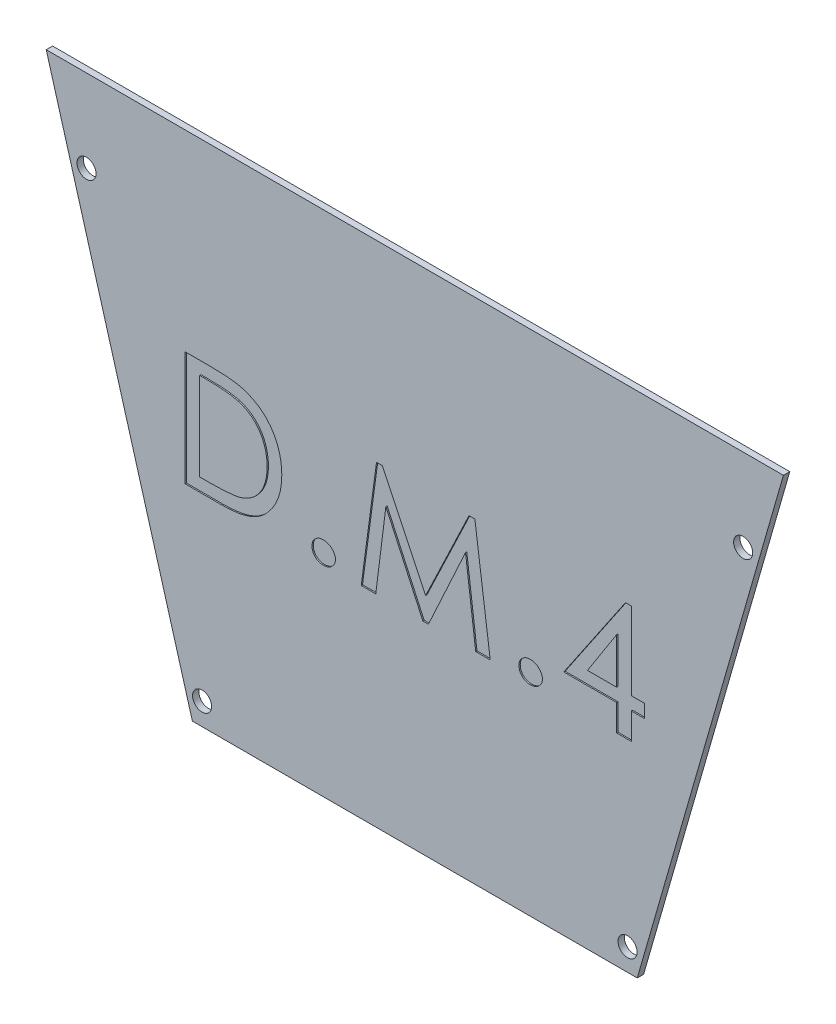
from build123d import *

# Parameters (mm, degrees)
SKETCH4_R           = 1.5
BOSS_EXTRUDE2_DEPTH = 2
CUT_EXTRUDE3_DEPTH  = 1.2
SKETCH5_W           = 128.44998767
SKETCH5_H           = 88.567800429
CUT_EXTRUDE4_DEPTH  = 1


with BuildPart() as part:
    # Sketch4 → Boss-Extrude2 (new body)
    with BuildSketch(Plane.XY):
        Polygon((-47.494923858, -80), (22.505076142, -80), (45.505076142, 0), (-70.494923858, 0), align=None)
        with Locations((-64.156154636, -13)):
            Circle(SKETCH4_R, mode=Mode.SUBTRACT)
        with Locations((39.166306921, -13)):
            Circle(SKETCH4_R, mode=Mode.SUBTRACT)
        with Locations((20.975017364, -76.5)):
            Circle(SKETCH4_R, mode=Mode.SUBTRACT)
        with Locations((-45.96486508, -76.5)):
            Circle(SKETCH4_R, mode=Mode.SUBTRACT)
    extrude(amount=BOSS_EXTRUDE2_DEPTH)

    # Sketch3 → Cut-Extrude3 (cut)
    # profile 1 of 5: a face of its own
    with BuildSketch(Plane.XY.offset(2)):
        with BuildLine():
            Line((-48.652053032, -48.226415595), (-48.652053032, -30.234748929))
            Line((-48.652053032, -30.234748929), (-44.842519445, -30.234748929))
            add(Edge.make_bspline(
                [(-44.842519445, -30.234748929), (-44.521732269, -30.236984898), (-43.904050046, -30.241290301), (-43.011097962, -30.269525004), (-42.187594278, -30.318075085), (-41.431774393, -30.391255361), (-40.744397653, -30.4773218), (-40.125682471, -30.591186172), (-39.573264137, -30.713931405), (-39.23499855, -30.826811234), (-39.075959616, -30.87988281)],
                knots=[0, 0, 0, 0, 1.321377177, 2.544338591, 3.679698859, 4.71869479, 5.671952218, 6.531967125, 7.309789724, 8, 8, 8, 8], degree=3))
            add(Edge.make_bspline(
                [(-39.075959616, -30.87988281), (-38.85328765, -30.963788376), (-38.413791158, -31.129396122), (-37.791084053, -31.440263208), (-37.202775864, -31.781317579), (-36.656196712, -32.168455074), (-36.152390349, -32.599236902), (-35.682710646, -33.064254187), (-35.26164963, -33.577064823), (-34.875955514, -34.123196107), (-34.53421448, -34.703279623), (-34.238407999, -35.309695911), (-33.988574294, -35.941280549), (-33.783106651, -36.596425788), (-33.625638845, -37.276310988), (-33.509278481, -37.979086465), (-33.439750425, -38.706570709), (-33.432172128, -39.200397751), (-33.428335083, -39.450432356)],
                knots=[0, 0, 0, 0, 1.037989101, 2.048720264, 3.03347809, 4.003905725, 4.967380877, 5.923996735, 6.884742632, 7.859453364, 8.839691521, 9.819957728, 10.801471334, 11.80152298, 12.813966534, 13.844978706, 14.908869198, 16, 16, 16, 16], degree=3))
            add(Edge.make_bspline(
                [(-33.428335083, -39.450432356), (-33.431687273, -39.666796352), (-33.438309227, -40.094204144), (-33.494324081, -40.727210114), (-33.582972853, -41.342450534), (-33.709687032, -41.939530979), (-33.871706572, -42.517606235), (-34.071313773, -43.078299747), (-34.304009234, -43.622326227), (-34.575295239, -44.143488737), (-34.872666915, -44.640220911), (-35.197779254, -45.105368313), (-35.544154758, -45.539087338), (-35.912590068, -45.941421262), (-36.306511511, -46.310238673), (-36.725402521, -46.645257464), (-37.166786838, -46.94990625), (-37.634932409, -47.222083119), (-38.138587554, -47.464070392), (-38.687036048, -47.667176718), (-39.281362533, -47.838976891), (-39.920972409, -47.985046491), (-40.609225659, -48.089034767), (-41.342714631, -48.167737193), (-42.121853938, -48.22071111), (-42.657143011, -48.224478632), (-42.932346501, -48.226415595)],
                knots=[0, 0, 0, 0, 1.058131973, 2.090245403, 3.105765157, 4.096918797, 5.07359586, 6.040054961, 7.006085223, 7.965371986, 8.911666288, 9.835956746, 10.738988486, 11.624821356, 12.502036588, 13.375701924, 14.24610047, 15.122941669, 16.021834204, 16.975760622, 17.979893693, 19.046217526, 20.182340398, 21.382202726, 22.654134781, 24, 24, 24, 24], degree=3))
            Line((-42.932346501, -48.226415595), (-48.652053032, -48.226415595))
        make_face()
        with BuildLine():
            Line((-46.3454291, -46.150454057), (-44.781249747, -46.150454057))
            add(Edge.make_bspline(
                [(-44.781249747, -46.150454057), (-44.492899092, -46.149343471), (-43.938936926, -46.147209879), (-43.142408274, -46.1235595), (-42.415026871, -46.095321415), (-41.759126132, -46.042892613), (-41.17326892, -45.984380401), (-40.657443035, -45.908775227), (-40.209539607, -45.823754328), (-39.939260695, -45.743914961), (-39.814800094, -45.70714977)],
                knots=[0, 0, 0, 0, 1.383618687, 2.658126108, 3.823786659, 4.876093986, 5.815132222, 6.648351516, 7.377580062, 8, 8, 8, 8], degree=3))
            add(Edge.make_bspline(
                [(-39.814800094, -45.70714977), (-39.6600924, -45.651838811), (-39.354494958, -45.54258188), (-38.916610947, -45.339271993), (-38.503920133, -45.104752957), (-38.117806568, -44.836912218), (-37.755008885, -44.539271508), (-37.415238372, -44.212167443), (-37.104536837, -43.848874073), (-36.820983796, -43.456614196), (-36.564053875, -43.038059452), (-36.34074051, -42.594579956), (-36.151849844, -42.127073616), (-36.002731429, -41.636670636), (-35.882218903, -41.123993753), (-35.796467285, -40.588109651), (-35.745857751, -40.028064592), (-35.738633341, -39.647560428), (-35.734959015, -39.454036455)],
                knots=[0, 0, 0, 0, 0.982760408, 1.941267819, 2.884666843, 3.819923004, 4.749609063, 5.690155114, 6.638335438, 7.60609908, 8.583824457, 9.574050268, 10.573936541, 11.597196452, 12.638231748, 13.723193679, 14.842018967, 16, 16, 16, 16], degree=3))
            add(Edge.make_bspline(
                [(-35.734959015, -39.454036455), (-35.737854869, -39.250837503), (-35.743555962, -38.85079797), (-35.805429384, -38.262579417), (-35.891905451, -37.695768852), (-36.022150292, -37.152045101), (-36.193769575, -36.63309464), (-36.392918993, -36.133041955), (-36.637299067, -35.659592329), (-36.913689135, -35.209680937), (-37.222475105, -34.787997614), (-37.563789678, -34.400981017), (-37.931335936, -34.044514412), (-38.334018181, -33.729348877), (-38.76041402, -33.440466019), (-39.219289528, -33.194098078), (-39.705637279, -32.977796498), (-40.045587995, -32.865288613), (-40.218459282, -32.808076252)],
                knots=[0, 0, 0, 0, 1.129217777, 2.223100788, 3.284889252, 4.31516385, 5.326848226, 6.321524555, 7.304244934, 8.284784113, 9.254596696, 10.205833222, 11.15055266, 12.096616828, 13.045035565, 14.010353181, 14.988227444, 16, 16, 16, 16], degree=3))
            add(Edge.make_bspline(
                [(-40.218459282, -32.808076252), (-40.364599858, -32.7678761), (-40.675031922, -32.682482867), (-41.181011814, -32.583884072), (-41.751176095, -32.499362698), (-42.388161486, -32.426922906), (-43.089071395, -32.374061283), (-43.85717155, -32.340940227), (-44.689748316, -32.313115537), (-45.267776043, -32.311530716), (-45.566943523, -32.310710467)],
                knots=[0, 0, 0, 0, 0.675026783, 1.433893058, 2.294494921, 3.24250292, 4.28921909, 5.425097092, 6.667317884, 8, 8, 8, 8], degree=3))
            Line((-45.566943523, -32.310710467), (-46.3454291, -32.310710467))
            Line((-46.3454291, -32.310710467), (-46.3454291, -46.150454057))
        make_face(mode=Mode.SUBTRACT)
    # profile 2 of 5: a face of its own
    with BuildSketch(Plane.XY.offset(2)):
        with BuildLine():
            add(Edge.make_bspline(
                [(-26.946721835, -44.997142091), (-26.806680668, -45.002504375), (-26.537004134, -45.012830497), (-26.154075896, -45.116505736), (-25.8130484, -45.288718544), (-25.527228724, -45.528001783), (-25.287573837, -45.797894802), (-25.117404297, -46.094094181), (-25.002175777, -46.404062535), (-24.991464711, -46.619190744), (-24.986091493, -46.72711004)],
                knots=[0, 0, 0, 0, 1.15701891, 2.228065191, 3.255424824, 4.294461548, 5.295444851, 6.226722199, 7.110433302, 8, 8, 8, 8], degree=3))
            add(Edge.make_bspline(
                [(-24.986091493, -46.72711004), (-24.991948756, -46.833678853), (-25.003668892, -47.046918572), (-25.112596671, -47.357393828), (-25.285401821, -47.652921655), (-25.522329126, -47.925876437), (-25.808605405, -48.166326907), (-26.153066708, -48.332984656), (-26.535162458, -48.442421855), (-26.806556781, -48.452086539), (-26.946721835, -48.457077989)],
                knots=[0, 0, 0, 0, 0.879435236, 1.759712977, 2.690738283, 3.698978083, 4.737733602, 5.760330622, 6.843294226, 8, 8, 8, 8], degree=3))
            add(Edge.make_bspline(
                [(-26.946721835, -48.457077989), (-27.06267292, -48.45079593), (-27.290124516, -48.438472937), (-27.617782904, -48.342360995), (-27.915046866, -48.17853471), (-28.179883776, -47.960352663), (-28.399393832, -47.694867761), (-28.560241031, -47.396221565), (-28.658730732, -47.069558301), (-28.670605406, -46.843128669), (-28.676689784, -46.72711004)],
                knots=[0, 0, 0, 0, 1.022542034, 2.005835645, 2.98339371, 4.000421564, 5.017449418, 6.004339308, 6.977457966, 8, 8, 8, 8], degree=3))
            add(Edge.make_bspline(
                [(-28.676689784, -46.72711004), (-28.670522302, -46.609932358), (-28.658484682, -46.381226332), (-28.561793293, -46.052589512), (-28.399262441, -45.755446732), (-28.178633488, -45.4938607), (-27.914639153, -45.274306589), (-27.615792067, -45.113624856), (-27.28918097, -45.015092187), (-27.062744148, -45.003223435), (-26.946721835, -44.997142091)],
                knots=[0, 0, 0, 0, 1.03279153, 2.015790415, 2.993055472, 4.001620375, 5.018343391, 6.004937476, 6.977764458, 8, 8, 8, 8], degree=3))
        make_face()
    # profile 3 of 5: a face of its own
    with BuildSketch(Plane.XY.offset(2)):
        Polygon((-20.926433374, -48.226415595), (-18.522498745, -30.234748929), (-17.614265572, -30.234748929), (-10.791704474, -44.535817305), (-3.969143376, -30.234748929), (-3.046493804, -30.234748929), (-0.628142775, -48.226415595), (-2.916746208, -48.226415595), (-4.51696656, -35.539983972), (-10.355608387, -48.226415595), (-11.227800561, -48.226415595), (-17.048421889, -35.539983972), (-18.641434041, -48.226415595), align=None)
    # profile 4 of 5: a face of its own
    with BuildSketch(Plane.XY.offset(2)):
        with BuildLine():
            add(Edge.make_bspline(
                [(5.622808079, -44.997142091), (5.762849247, -45.002504375), (6.032525781, -45.012830497), (6.415454018, -45.116505736), (6.756481514, -45.288718544), (7.042301191, -45.528001783), (7.281956078, -45.797894802), (7.452125617, -46.094094181), (7.567354138, -46.404062535), (7.578065204, -46.619190744), (7.583438421, -46.72711004)],
                knots=[0, 0, 0, 0, 1.15701891, 2.228065191, 3.255424824, 4.294461548, 5.295444851, 6.226722199, 7.110433302, 8, 8, 8, 8], degree=3))
            add(Edge.make_bspline(
                [(7.583438421, -46.72711004), (7.577581159, -46.833678853), (7.565861022, -47.046918572), (7.456933243, -47.357393828), (7.284128093, -47.652921655), (7.047200788, -47.925876437), (6.760924509, -48.166326907), (6.416463207, -48.332984656), (6.034367456, -48.442421855), (5.762973134, -48.452086539), (5.622808079, -48.457077989)],
                knots=[0, 0, 0, 0, 0.879435236, 1.759712977, 2.690738283, 3.698978083, 4.737733602, 5.760330622, 6.843294226, 8, 8, 8, 8], degree=3))
            add(Edge.make_bspline(
                [(5.622808079, -48.457077989), (5.506856995, -48.45079593), (5.279405398, -48.438472937), (4.951747011, -48.342360995), (4.654483049, -48.17853471), (4.389646138, -47.960352663), (4.170136082, -47.694867761), (4.009288884, -47.396221565), (3.910799182, -47.069558301), (3.898924508, -46.843128669), (3.892840131, -46.72711004)],
                knots=[0, 0, 0, 0, 1.022542034, 2.005835645, 2.98339371, 4.000421564, 5.017449418, 6.004339308, 6.977457966, 8, 8, 8, 8], degree=3))
            add(Edge.make_bspline(
                [(3.892840131, -46.72711004), (3.899007613, -46.609932358), (3.911045232, -46.381226332), (4.007736622, -46.052589512), (4.170267474, -45.755446732), (4.390896427, -45.4938607), (4.654890761, -45.274306589), (4.953737848, -45.113624856), (5.280348944, -45.015092187), (5.506785767, -45.003223435), (5.622808079, -44.997142091)],
                knots=[0, 0, 0, 0, 1.03279153, 2.015790415, 2.993055472, 4.001620375, 5.018343391, 6.004937476, 6.977764458, 8, 8, 8, 8], degree=3))
        make_face()
    # profile 5 of 5: a face of its own
    with BuildSketch(Plane.XY.offset(2)):
        Polygon((20.649742174, -29.773424142), (21.561579447, -29.773424142), (21.561579447, -41.99853098), (23.637540985, -41.99853098), (23.637540985, -44.074492519), (21.561579447, -44.074492519), (21.561579447, -48.226415595), (19.254955515, -48.226415595), (19.254955515, -44.074492519), (10.951109361, -44.074492519), align=None)
        Polygon((19.254955515, -41.99853098), (19.254955515, -34.844392692), (14.674144551, -41.99853098), align=None, mode=Mode.SUBTRACT)
    extrude(amount=-CUT_EXTRUDE3_DEPTH, mode=Mode.SUBTRACT)

    # Sketch5 → Cut-Extrude4 (cut)
    with BuildSketch(Plane.XY.offset(2)):
        with Locations((-12.895079583, -39.666536896)):
            Rectangle(SKETCH5_W, SKETCH5_H)
    extrude(amount=-CUT_EXTRUDE4_DEPTH, mode=Mode.SUBTRACT)


solid = part.part
